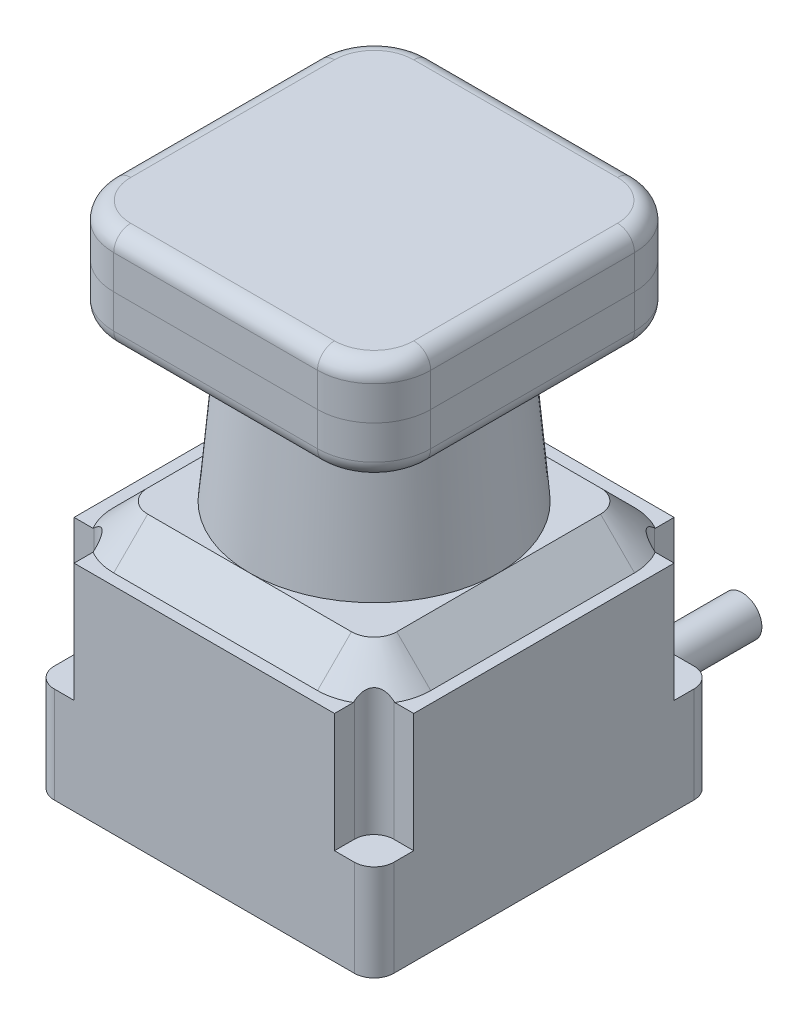
from build123d import *

# Parameters (mm, degrees)
BOSS_EXTRUDE1_DEPTH = 38
BOSS_EXTRUDE2_DEPTH = 6
BOSS_EXTRUDE2_TAPER = 45
CUT_EXTRUDE3_START  = -21
CUT_EXTRUDE3_DEPTH  = 78.956123464
CIRPATTERN1_COUNT   = 4
SKETCH5_R           = 3.5
BOSS_EXTRUDE3_DEPTH = 20
BOSS_EXTRUDE4_DEPTH = 18
FILLET1_R           = 3


with BuildPart() as part:
    # Sketch1 → Boss-Extrude1 (new body)
    with BuildSketch(Plane(origin=(0, 0, 0), x_dir=(1, 0, 0), z_dir=(0, 1, 0))):
        with BuildLine():
            Line((-26.5, -30), (26.5, -30))
            ThreePointArc((26.5, -30), (28.974873734, -28.974873734), (30, -26.5))
            Line((30, -26.5), (30, 26.5))
            ThreePointArc((30, 26.5), (28.974873734, 28.974873734), (26.5, 30))
            Line((26.5, 30), (-26.5, 30))
            ThreePointArc((-26.5, 30), (-28.974873734, 28.974873734), (-30, 26.5))
            Line((-30, 26.5), (-30, -26.5))
            ThreePointArc((-30, -26.5), (-28.974873734, -28.974873734), (-26.5, -30))
        make_face()
    extrude(amount=BOSS_EXTRUDE1_DEPTH)

    # Sketch2 → Boss-Extrude2 (add)
    with BuildSketch(Plane(origin=(0, 38, 0), x_dir=(1, 0, 0), z_dir=(0, 1, 0))):
        with BuildLine():
            Line((-18, -28), (18, -28))
            ThreePointArc((18, -28), (25.071067812, -25.071067812), (28, -18))
            Line((28, -18), (28, 18))
            ThreePointArc((28, 18), (25.071067812, 25.071067812), (18, 28))
            Line((18, 28), (-18, 28))
            ThreePointArc((-18, 28), (-25.071067812, 25.071067812), (-28, 18))
            Line((-28, 18), (-28, -18))
            ThreePointArc((-28, -18), (-25.071067812, -25.071067812), (-18, -28))
        make_face()
    extrude(amount=BOSS_EXTRUDE2_DEPTH, taper=BOSS_EXTRUDE2_TAPER)

    # Sketch3 → Cut-Extrude3 (cut)
    with BuildSketch(Plane(origin=(0, 38, 0), x_dir=(1, 0, 0), z_dir=(0, 1, 0)).offset(CUT_EXTRUDE3_START)):
        with BuildLine():
            ThreePointArc((26.660254038, -23), (25.071067812, -25.071067812), (23, -26.660254038))
            Line((23, -26.660254038), (23, -30))
            Line((23, -30), (26.5, -30))
            ThreePointArc((26.5, -30), (28.974873734, -28.974873734), (30, -26.5))
            Line((30, -26.5), (30, -23))
            Line((30, -23), (26.660254038, -23))
        make_face()
        with BuildLine():
            ThreePointArc((26.5, -23), (24.025126266, -24.025126266), (23, -26.5))
            Line((23, -26.5), (23, -26.660254038))
            ThreePointArc((23, -26.660254038), (25.071067812, -25.071067812), (26.660254038, -23))
            Line((26.660254038, -23), (26.5, -23))
        make_face()
    cut_extrude3 = extrude(amount=CUT_EXTRUDE3_DEPTH, mode=Mode.SUBTRACT)

    # CirPattern1: Cut-Extrude3 ×4 about axis
    cirpattern1_axis = Axis((0, 0, 0), (0, 1, 0))
    for i in range(1, CIRPATTERN1_COUNT):
        add(cut_extrude3.rotate(cirpattern1_axis, i * 360 / CIRPATTERN1_COUNT), mode=Mode.SUBTRACT)

    # Sketch4 → Revolve1 (revolve)
    with BuildSketch(Plane.XY, mode=Mode.PRIVATE) as revolve1_sk:
        Polygon((0, 44), (0, 72), (19.550317421, 72), (22, 44), align=None)
    revolve(revolve1_sk.sketch.rotate(Axis((0, -2.2, 0), (0, 1, 0)), 90), axis=Axis((0, -2.2, 0), (0, 1, 0)))

    # Sketch5 → Boss-Extrude3 (add)
    with BuildSketch(Plane(origin=(0, 0, -30), x_dir=(-1, 0, 0), z_dir=(0, 0, -1))):
        with Locations(Location((-15, 9, 0), (0, 0, 180))):
            Circle(SKETCH5_R)
        with Locations(Location((15, 9, 0), (0, 0, 180))):
            Circle(SKETCH5_R)
    extrude(amount=BOSS_EXTRUDE3_DEPTH)

    # Sketch6 → Boss-Extrude4 (add)
    with BuildSketch(Plane(origin=(0, 72, 0), x_dir=(1, 0, 0), z_dir=(0, 1, 0))):
        with BuildLine():
            Line((-18, -28), (18, -28))
            ThreePointArc((18, -28), (25.071067812, -25.071067812), (28, -18))
            Line((28, -18), (28, 18))
            ThreePointArc((28, 18), (25.071067812, 25.071067812), (18, 28))
            Line((18, 28), (-18, 28))
            ThreePointArc((-18, 28), (-25.071067812, 25.071067812), (-28, 18))
            Line((-28, 18), (-28, -18))
            ThreePointArc((-28, -18), (-25.071067812, -25.071067812), (-18, -28))
        make_face()
    extrude(amount=BOSS_EXTRUDE4_DEPTH)

    # Fillet1
    fillet1_edges = [part.edges().sort_by_distance(p)[0] for p in [
        (25.071067812, 72, 25.071067812),
        (28, 72, 0),
        (25.071067812, 72, -25.071067812),
        (0, 72, -28),
        (-25.071067812, 72, -25.071067812),
        (-28, 72, 0),
        (-25.071067812, 72, 25.071067812),
        (0, 72, 28),
        (25.071067812, 90, 25.071067812),
        (28, 90, 0),
        (25.071067812, 90, -25.071067812),
        (0, 90, -28),
        (-25.071067812, 90, -25.071067812),
        (-28, 90, 0),
        (-25.071067812, 90, 25.071067812),
        (0, 90, 28),
    ]]
    fillet(fillet1_edges, radius=FILLET1_R)


solid = part.part
